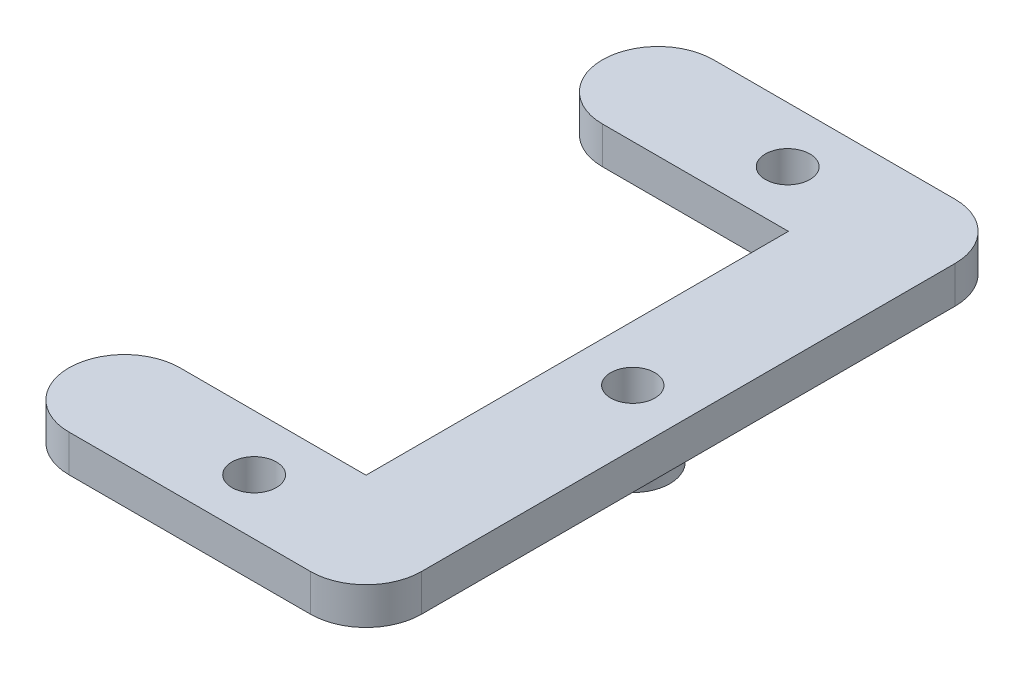
from build123d import *

# Parameters (mm, degrees)
SKETCH1_R           = 1.5
BOSS_EXTRUDE1_DEPTH = 2.5
SKETCH2_R           = 2.5
BOSS_EXTRUDE2_DEPTH = 2
SKETCH3_R           = 1.49
CUT_EXTRUDE1_DEPTH  = 7


with BuildPart() as part:
    # Sketch1 → Boss-Extrude1 (new body)
    with BuildSketch(Plane(origin=(0, 0, 0), x_dir=(1, 0, 0), z_dir=(0, 1, 0))):
        with BuildLine():
            Line((-8.75, 14.25), (3.8, 14.25))
            Line((3.8, 14.25), (3.8, -14.25))
            Line((3.8, -14.25), (-8.75, -14.25))
            ThreePointArc((-8.75, -14.25), (-12.5, -18), (-8.75, -21.75))
            Line((-8.75, -21.75), (7.55, -21.75))
            ThreePointArc((7.55, -21.75), (10.201650429, -20.651650429), (11.3, -18))
            Line((11.3, -18), (11.3, 18))
            ThreePointArc((11.3, 18), (10.201650429, 20.651650429), (7.55, 21.75))
            Line((7.55, 21.75), (-8.75, 21.75))
            ThreePointArc((-8.75, 21.75), (-12.5, 18), (-8.75, 14.25))
        make_face()
        with Locations(Location((0, 18, 0), (0, 0, 270))):
            Circle(SKETCH1_R, mode=Mode.SUBTRACT)
        with Locations(Location((0, -18, 0), (0, 0, 270))):
            Circle(SKETCH1_R, mode=Mode.SUBTRACT)
    extrude(amount=BOSS_EXTRUDE1_DEPTH)

    # Sketch2 → Boss-Extrude2 (add)
    with BuildSketch(Plane.XZ):
        with Locations(Location((7.55, 0, 0), (0, 0, 90))):
            Circle(SKETCH2_R)
    extrude(amount=BOSS_EXTRUDE2_DEPTH)

    # Sketch3 → Cut-Extrude1 (cut)
    with BuildSketch(Plane.XZ.offset(2)):
        with Locations(Location((7.55, 0, 0), (0, 0, 270))):
            Circle(SKETCH3_R)
    extrude(amount=-CUT_EXTRUDE1_DEPTH, mode=Mode.SUBTRACT)


solid = part.part
